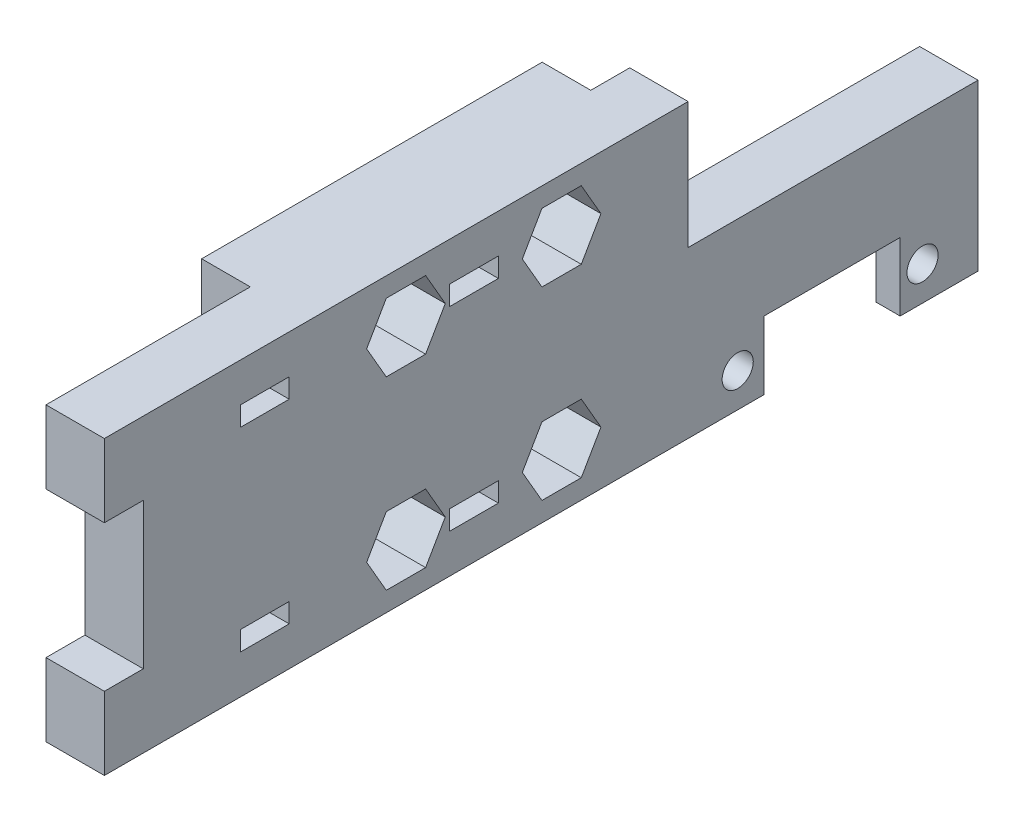
from build123d import *

# Parameters (mm, degrees)
BOSS_EXTRUDE1_DEPTH = 30
CUT_EXTRUDE1_REACH  = 53.981
SKETCH2_R           = 2.1
CUT_EXTRUDE2_DEPTH  = 6
SKETCH4_W           = 5
SKETCH4_H           = 2
CUT_EXTRUDE3_DEPTH  = 52.980765673
SKETCH5_W           = 5
SKETCH5_H           = 18
CUT_EXTRUDE4_DEPTH  = 5
SKETCH6_W           = 4
SKETCH6_H           = 15
CUT_EXTRUDE5_DEPTH  = 52.15662225
BOSS_EXTRUDE2_DEPTH = 5
SKETCH7_W           = 2
SKETCH7_H           = 12
CUT_EXTRUDE6_DEPTH  = 51.418250664
LPATTERN1_COUNT     = 2
LPATTERN1_PITCH     = 16
BOSS_EXTRUDE3_DEPTH = 2.5
SKETCH10_W          = 29.8
SKETCH10_H          = 9
BOSS_EXTRUDE4_DEPTH = 3.5
SKETCH11_R          = 1.6
CUT_EXTRUDE7_DEPTH  = 59.330438023


with BuildPart() as part:
    # Sketch1 → Boss-Extrude1 (new body)
    with BuildSketch(Plane(origin=(0, 0, 0), x_dir=(1, 0, 0), z_dir=(0, 1, 0))):
        Polygon((0, 0), (5, 0), (5, 19), (11, 19), (11, -41), (5, -41), (5, -20), (0, -20), align=None)
    extrude(amount=BOSS_EXTRUDE1_DEPTH)

    # Sketch2 → Cut-Extrude1 (cut, up to next)
    with BuildSketch(Plane(origin=(11, 0, 0), x_dir=(0, 0, -1), z_dir=(1, 0, 0)), mode=Mode.PRIVATE) as cut_extrude1_sk1:
        with Locations((-10, 24.5)):
            Circle(SKETCH2_R)
    cut_extrude1_tool1 = extrude(cut_extrude1_sk1.sketch, amount=-CUT_EXTRUDE1_REACH, mode=Mode.PRIVATE) & part.part
    # Sketch2 → Cut-Extrude1 (cut, up to next)
    with BuildSketch(Plane(origin=(11, 0, 0), x_dir=(0, 0, -1), z_dir=(1, 0, 0)), mode=Mode.PRIVATE) as cut_extrude1_sk2:
        with Locations((-10, 5.5)):
            Circle(SKETCH2_R)
    cut_extrude1_tool2 = extrude(cut_extrude1_sk2.sketch, amount=-CUT_EXTRUDE1_REACH, mode=Mode.PRIVATE) & part.part
    cut_extrude1_1 = cut_extrude1_tool1.solids().sort_by_distance((11, 24.5, 10))[0]
    add(cut_extrude1_1, mode=Mode.SUBTRACT)
    cut_extrude1_2 = cut_extrude1_tool2.solids().sort_by_distance((11, 5.5, 10))[0]
    add(cut_extrude1_2, mode=Mode.SUBTRACT)
    cut_extrude1 = cut_extrude1_1 + cut_extrude1_2  # Cut-Extrude1 as one shape, for the pattern or mirror that repeats it

    # Sketch3 → Cut-Extrude2 (cut)
    with BuildSketch(Plane(origin=(11, 0, 0), x_dir=(0, 0, -1), z_dir=(1, 0, 0))):
        Polygon((-14.041451884, 24.5), (-12.020725942, 21), (-7.979274058, 21), (-5.958548116, 24.5), (-7.979274058, 28), (-12.020725942, 28), align=None)
        Polygon((-14.041451884, 5.5), (-12.020725942, 2), (-7.979274058, 2), (-5.958548116, 5.5), (-7.979274058, 9), (-12.020725942, 9), align=None)
    cut_extrude2 = extrude(amount=-CUT_EXTRUDE2_DEPTH, mode=Mode.SUBTRACT)

    # Sketch4 → Cut-Extrude3 (cut, through all)
    with BuildSketch(Plane(origin=(11, 0, 0), x_dir=(0, 0, -1), z_dir=(1, 0, 0))):
        with Locations((-24.5, 25)):
            Rectangle(SKETCH4_W, SKETCH4_H)
        with Locations((-24.5, 5)):
            Rectangle(SKETCH4_W, SKETCH4_H)
        with Locations((-3, 25)):
            Rectangle(SKETCH4_W, SKETCH4_H)
        with Locations((-3, 5)):
            Rectangle(SKETCH4_W, SKETCH4_H)
    extrude(amount=-CUT_EXTRUDE3_DEPTH, mode=Mode.SUBTRACT)

    # Sketch5 → Cut-Extrude4 (cut)
    with BuildSketch(Plane.ZY):
        with Locations((3, 15)):
            Rectangle(SKETCH5_W, SKETCH5_H)
    extrude(amount=-CUT_EXTRUDE4_DEPTH, mode=Mode.SUBTRACT)

    # Sketch6 → Cut-Extrude5 (cut, through all)
    with BuildSketch(Plane.ZY.offset(-5)):
        with Locations((39, 15)):
            Rectangle(SKETCH6_W, SKETCH6_H)
    extrude(amount=-CUT_EXTRUDE5_DEPTH, mode=Mode.SUBTRACT)

    # Sketch8 → Boss-Extrude2 (add)
    with BuildSketch(Plane.ZY.offset(-5)):
        Polygon((0, 30), (0, 14.791308029), (0, 0), (-15, 0), (-15, 30), align=None)
    extrude(amount=BOSS_EXTRUDE2_DEPTH)

    # Sketch7 → Cut-Extrude6 (cut, through all)
    with BuildSketch(Plane.XY.offset(20)):
        with Locations((1, 15)):
            Rectangle(SKETCH7_W, SKETCH7_H)
    extrude(amount=-CUT_EXTRUDE6_DEPTH, mode=Mode.SUBTRACT)

    # LPattern1: Cut-Extrude1, Cut-Extrude2 ×2
    with Locations(*[(0, 0, -i * LPATTERN1_PITCH) for i in range(1, LPATTERN1_COUNT)]):
        add(cut_extrude1, mode=Mode.SUBTRACT)
        add(cut_extrude2, mode=Mode.SUBTRACT)

    # Sketch9 → Boss-Extrude3 (add)
    with BuildSketch(Plane(origin=(11, 0, 0), x_dir=(0, 0, -1), z_dir=(1, 0, 0))):
        Polygon((19, 0), (26.8, 0), (26.8, 7), (40.8, 7), (40.8, 0), (48.8, 0), (48.8, 17), (19, 17), align=None)
    extrude(amount=-BOSS_EXTRUDE3_DEPTH)

    # Sketch10 → Boss-Extrude4 (add)
    with BuildSketch(Plane.ZY.offset(-8.5)):
        with Locations((-33.9, 12.5)):
            Rectangle(SKETCH10_W, SKETCH10_H)
    extrude(amount=BOSS_EXTRUDE4_DEPTH)

    # Sketch11 → Cut-Extrude7 (cut, through all)
    with BuildSketch(Plane(origin=(11, 0, 0), x_dir=(0, 0, -1), z_dir=(1, 0, 0))):
        with Locations((43.1, 3.5)):
            Circle(SKETCH11_R)
        with Locations((24.1, 3.5)):
            Circle(SKETCH11_R)
    extrude(amount=-CUT_EXTRUDE7_DEPTH, mode=Mode.SUBTRACT)


solid = part.part
